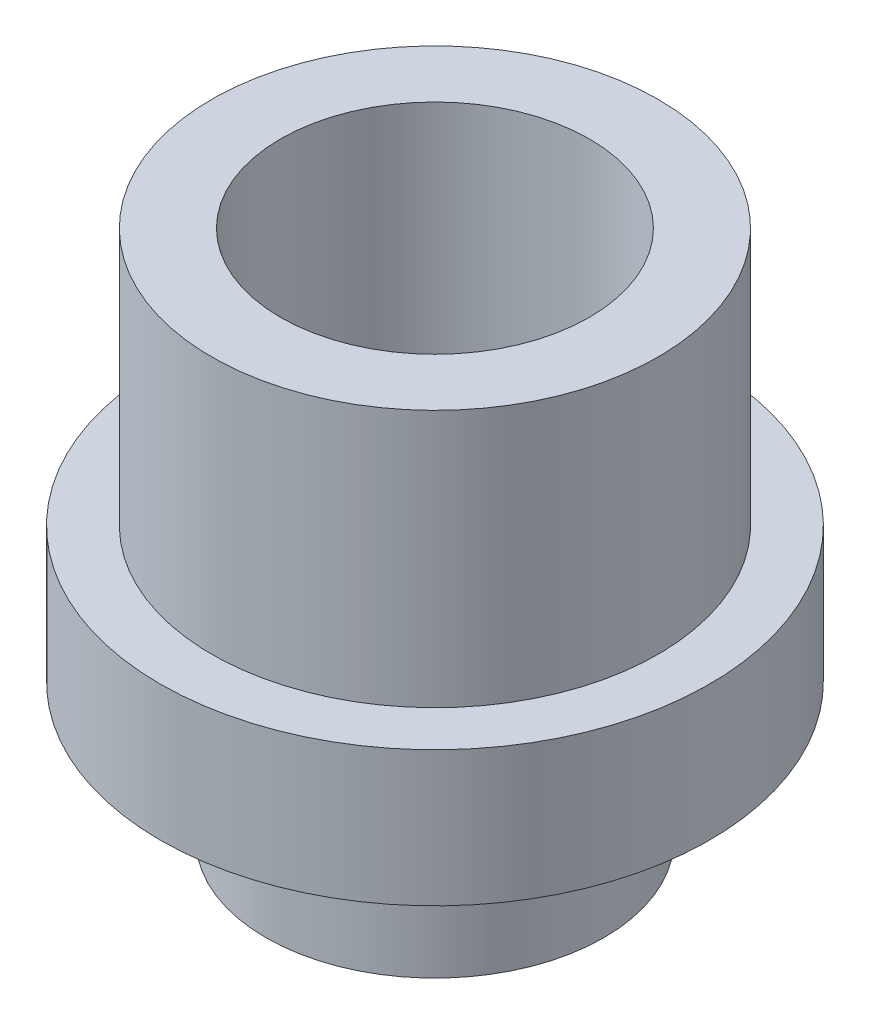
from build123d import *

# Parameters (mm, degrees)
SKETCH1_R           = 20.32
SKETCH1_R_2         = 4.09575
BOSS_EXTRUDE1_DEPTH = 10
SKETCH2_R           = 16.51
SKETCH2_R_2         = 11.43
BOSS_EXTRUDE2_DEPTH = 19.05
BOSS_EXTRUDE3_START = 10.16
SKETCH3_R           = 12.5
SKETCH3_R_2         = 4.09575
BOSS_EXTRUDE3_DEPTH = 10.16


with BuildPart() as part:
    # Sketch1 → Boss-Extrude1 (new body)
    with BuildSketch(Plane(origin=(0, 0, 0), x_dir=(1, 0, 0), z_dir=(0, 1, 0))):
        with Locations(Location((0, 0, 0), (0, 0, 270))):
            Circle(SKETCH1_R)
        with Locations(Location((0, 0, 0), (0, 0, 270))):
            Circle(SKETCH1_R_2, mode=Mode.SUBTRACT)
    extrude(amount=BOSS_EXTRUDE1_DEPTH)

    # Sketch2 → Boss-Extrude2 (add)
    with BuildSketch(Plane(origin=(0, 10, 0), x_dir=(1, 0, 0), z_dir=(0, 1, 0))):
        with Locations(Location((0, 0, 0), (0, 0, 90))):
            Circle(SKETCH2_R)
        with Locations(Location((0, 0, 0), (0, 0, 90))):
            Circle(SKETCH2_R_2, mode=Mode.SUBTRACT)
    extrude(amount=BOSS_EXTRUDE2_DEPTH)

    # Sketch3 → Boss-Extrude3 (add)
    with BuildSketch(Plane(origin=(0, 0, 0), x_dir=(-1, 0, 0), z_dir=(0, -1, 0)).offset(BOSS_EXTRUDE3_START)):
        with Locations(Location((0, 0, 0), (0, 0, 270))):
            Circle(SKETCH3_R)
        with Locations(Location((0, 0, 0), (0, 0, 90))):
            Circle(SKETCH3_R_2, mode=Mode.SUBTRACT)
    extrude(amount=-BOSS_EXTRUDE3_DEPTH)


solid = part.part
